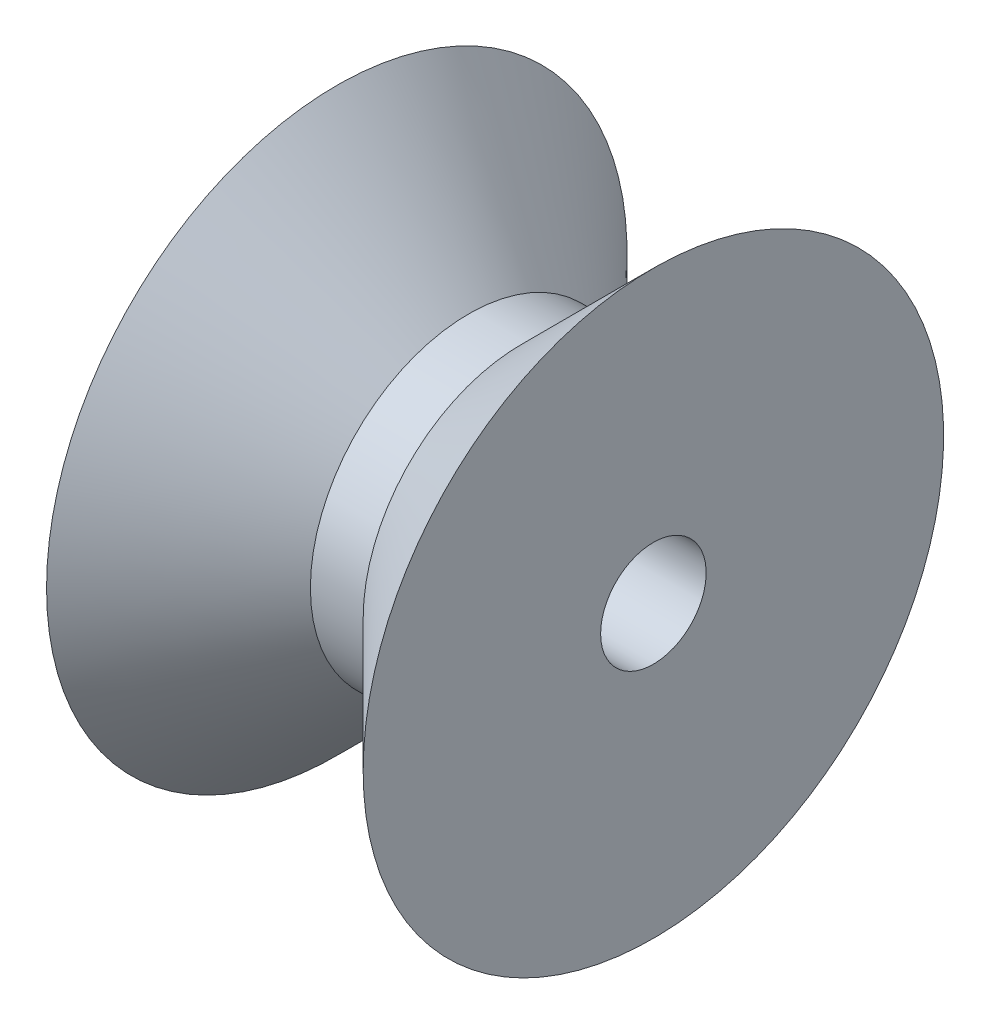
from build123d import *

# Parameters (mm, degrees)
SKETCH2_R          = 2
CUT_EXTRUDE2_DEPTH = 12


with BuildPart() as part:
    # Sketch1 → Revolve2 (revolve)
    with BuildSketch(Plane(origin=(0, 0, 0), x_dir=(1, 0, 0), z_dir=(0, 1, 0)), mode=Mode.PRIVATE) as revolve2_sk:
        Polygon((6, 0), (-6, 0), (-6, 11), (-1, 6), (1, 6), (6, 11), align=None)
    revolve(revolve2_sk.sketch.rotate(Axis((-30.177458034, 0, 0), (1, 0, 0)), 180), axis=Axis((-30.177458034, 0, 0), (1, 0, 0)))

    # Sketch2 → Cut-Extrude2 (cut)
    with BuildSketch(Plane.ZY.offset(6)):
        Circle(SKETCH2_R)
    extrude(amount=-CUT_EXTRUDE2_DEPTH, mode=Mode.SUBTRACT)


solid = part.part
